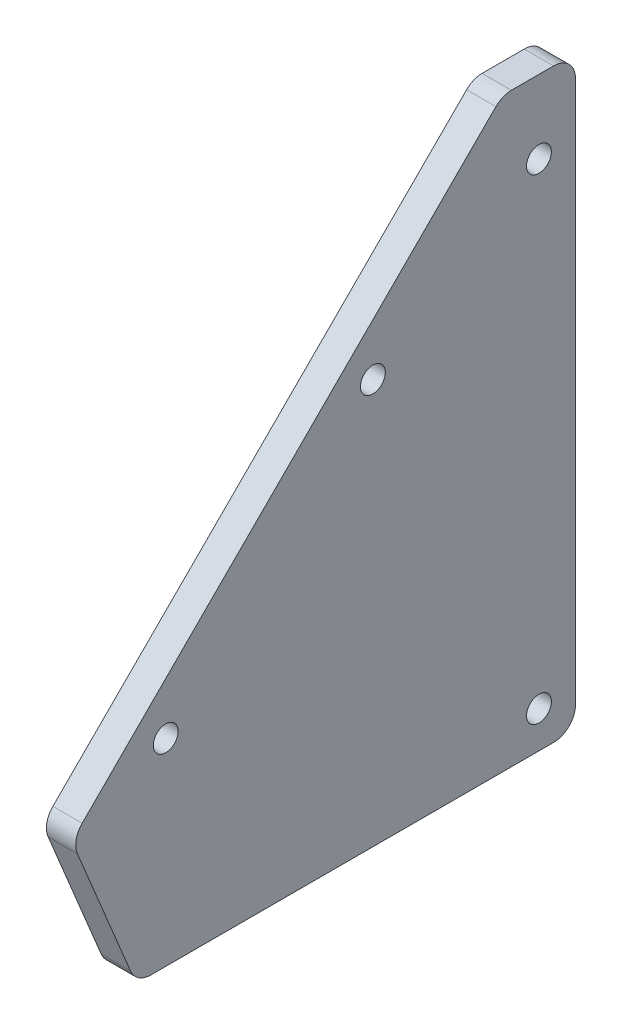
from build123d import *

# Parameters (mm, degrees)
SKETCH_3_R      = 1.7
EXTRUDE_3_DEPTH = 4
CHAMFER_1_SIZE  = 30
FILLET_1_R      = 3


with BuildPart() as part:
    # 草图3 → 凸台-拉伸3 (new body)
    with BuildSketch(Plane(origin=(0, 0, 0), x_dir=(0, 0, -1), z_dir=(1, 0, 0))):
        Polygon((0, 0), (80, 0), (90, 0), (90, 80), (80, 80), align=None)
        with Locations((85, 5)):
            Circle(SKETCH_3_R, mode=Mode.SUBTRACT)
        with Locations((85, 70)):
            Circle(SKETCH_3_R, mode=Mode.SUBTRACT)
        with Locations((62.32233047, 55.251262658)):
            Circle(SKETCH_3_R, mode=Mode.SUBTRACT)
        with Locations((34.038059223, 26.966991411)):
            Circle(SKETCH_3_R, mode=Mode.SUBTRACT)
    extrude(amount=EXTRUDE_3_DEPTH)

    # 倒角1
    chamfer_1_edges = [part.edges().sort_by_distance(p)[0] for p in [
        (2, 0, 0),
    ]]
    chamfer(chamfer_1_edges, length=CHAMFER_1_SIZE)

    # 圆角1
    fillet_1_edges = [part.edges().sort_by_distance(p)[0] for p in [
        (2, 0, -30),
        (2, 21.213203436, -21.213203436),
        (2, 80, -80),
        (2, 80, -90),
        (2, 0, -90),
    ]]
    fillet(fillet_1_edges, radius=FILLET_1_R)


solid = part.part
